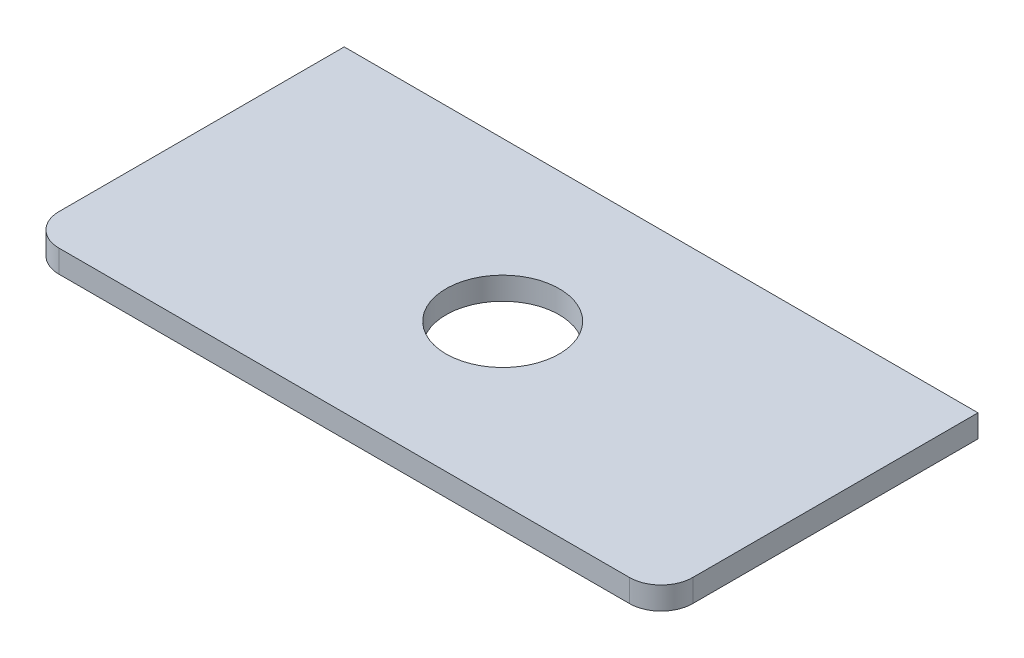
from build123d import *

# Parameters (mm, degrees)
SKETCH1_W           = 280
SKETCH1_H           = 140
BOSS_EXTRUDE1_DEPTH = 10
FILLET1_R           = 14
SKETCH2_R           = 25
CUT_EXTRUDE1_DEPTH  = 10


with BuildPart() as part:
    # Sketch1 → Boss-Extrude1 (new body)
    with BuildSketch(Plane(origin=(0, 0, 0), x_dir=(1, 0, 0), z_dir=(0, 1, 0))):
        Rectangle(SKETCH1_W, SKETCH1_H)
    extrude(amount=BOSS_EXTRUDE1_DEPTH)

    # Fillet1
    fillet1_edges = [part.edges().sort_by_distance(p)[0] for p in [
        (140, 5, 70),
        (-140, 5, 70),
    ]]
    fillet(fillet1_edges, radius=FILLET1_R)

    # Sketch2 → Cut-Extrude1 (cut)
    with BuildSketch(Plane(origin=(0, 10, 0), x_dir=(1, 0, 0), z_dir=(0, 1, 0))):
        with Locations(Location((0, 0, 0), (0, 0, 270))):
            Circle(SKETCH2_R)
    extrude(amount=-CUT_EXTRUDE1_DEPTH, mode=Mode.SUBTRACT)


solid = part.part
